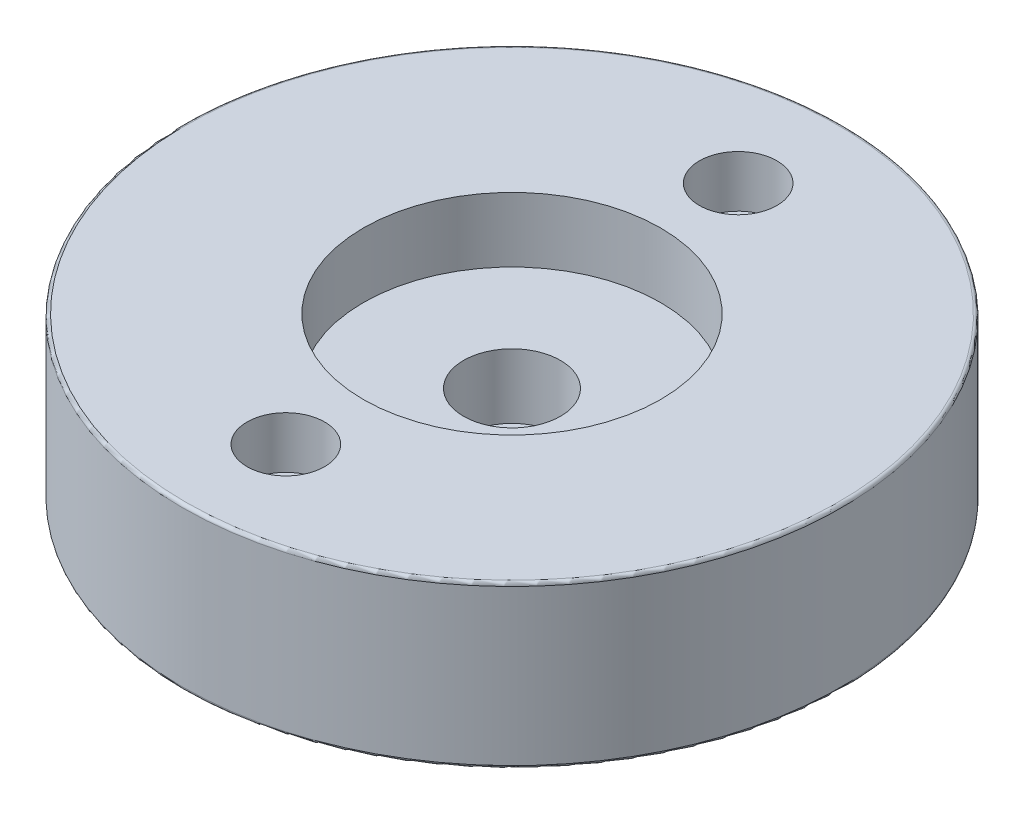
from build123d import *

# Parameters (mm, degrees)
SKETCH2_R           = 64.77
BOSS_EXTRUDE1_DEPTH = 31.75
FILLET1_R           = 0.635
SKETCH3_R           = 29.21
CUT_EXTRUDE1_DEPTH  = 12.7
SKETCH4_R           = 9.525
CUT_EXTRUDE2_DEPTH  = 12.7
SKETCH5_R           = 7.62
CUT_EXTRUDE3_DEPTH  = 10.16


with BuildPart() as part:
    # Sketch2 → Boss-Extrude1 (new body)
    with BuildSketch(Plane(origin=(0, 0, 0), x_dir=(1, 0, 0), z_dir=(0, 1, 0))):
        with Locations(Location((0, 0, 0), (0, 0, 270))):
            Circle(SKETCH2_R)
    extrude(amount=BOSS_EXTRUDE1_DEPTH)

    # Fillet1
    fillet1_edges = [part.edges().sort_by_distance(p)[0] for p in [
        (0, 0, -64.77),
        (0, 31.75, -64.77),
    ]]
    fillet(fillet1_edges, radius=FILLET1_R)

    # Sketch3 → Cut-Extrude1 (cut)
    with BuildSketch(Plane(origin=(0, 31.75, 0), x_dir=(1, 0, 0), z_dir=(0, 1, 0))):
        with Locations(Location((0, 0, 0), (0, 0, 270))):
            Circle(SKETCH3_R)
    extrude(amount=-CUT_EXTRUDE1_DEPTH, mode=Mode.SUBTRACT)

    # Sketch4 → Cut-Extrude2 (cut)
    with BuildSketch(Plane(origin=(0, 19.05, 0), x_dir=(1, 0, 0), z_dir=(0, 1, 0))):
        with Locations(Location((0, 0, 0), (0, 0, 270))):
            Circle(SKETCH4_R)
    extrude(amount=-CUT_EXTRUDE2_DEPTH, mode=Mode.SUBTRACT)

    # Sketch5 → Cut-Extrude3 (cut)
    with BuildSketch(Plane(origin=(0, 31.75, 0), x_dir=(1, 0, 0), z_dir=(0, 1, 0))):
        with Locations(Location((0, -44.45, 0), (0, 0, 270))):
            Circle(SKETCH5_R)
        with Locations(Location((0, 44.45, 0), (0, 0, 90))):
            Circle(SKETCH5_R)
    extrude(amount=-CUT_EXTRUDE3_DEPTH, mode=Mode.SUBTRACT)


solid = part.part
